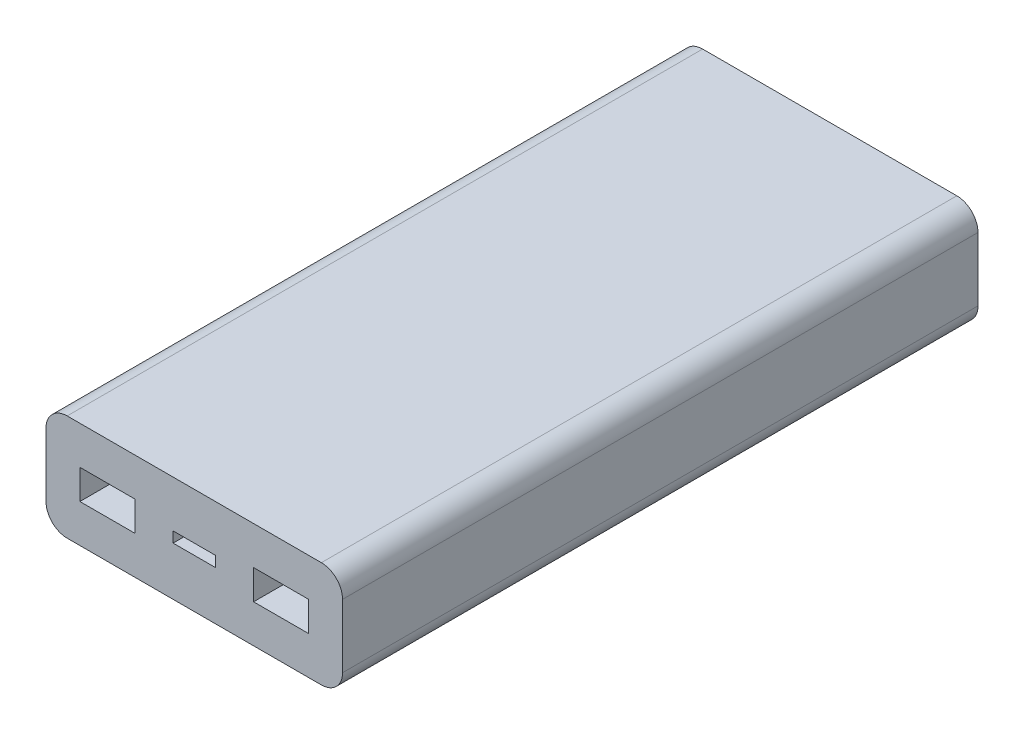
from build123d import *

# Parameters (mm, degrees)
ESQUISSE1_W             = 70
ESQUISSE1_H             = 25
BOSS_EXTRU_1_DEPTH      = 150
CONG_1_R                = 5
ESQUISSE2_W             = 13
ESQUISSE2_H             = 7
ESQUISSE2_W_2           = 10
ESQUISSE2_H_2           = 2.5
ENL_V_MAT_EXTRU_1_DEPTH = 11.5


with BuildPart() as part:
    # Esquisse1 → Boss.-Extru.1 (new body)
    with BuildSketch(Plane.XY):
        with Locations((35, 12.5)):
            Rectangle(ESQUISSE1_W, ESQUISSE1_H)
    extrude(amount=BOSS_EXTRU_1_DEPTH)

    # Congé1
    cong_1_edges = [part.edges().sort_by_distance(p)[0] for p in [
        (0, 25, 75),
        (70, 25, 75),
        (70, 0, 75),
        (0, 0, 75),
    ]]
    fillet(cong_1_edges, radius=CONG_1_R)

    # Esquisse2 → Enlèv. mat.-Extru.1 (cut)
    with BuildSketch(Plane.XY.offset(150)):
        with Locations((14.5, 12.5)):
            Rectangle(ESQUISSE2_W, ESQUISSE2_H)
        with Locations((55.5, 12.5)):
            Rectangle(ESQUISSE2_W, ESQUISSE2_H)
        with Locations((35, 12.75)):
            Rectangle(ESQUISSE2_W_2, ESQUISSE2_H_2)
    extrude(amount=-ENL_V_MAT_EXTRU_1_DEPTH, mode=Mode.SUBTRACT)


solid = part.part
